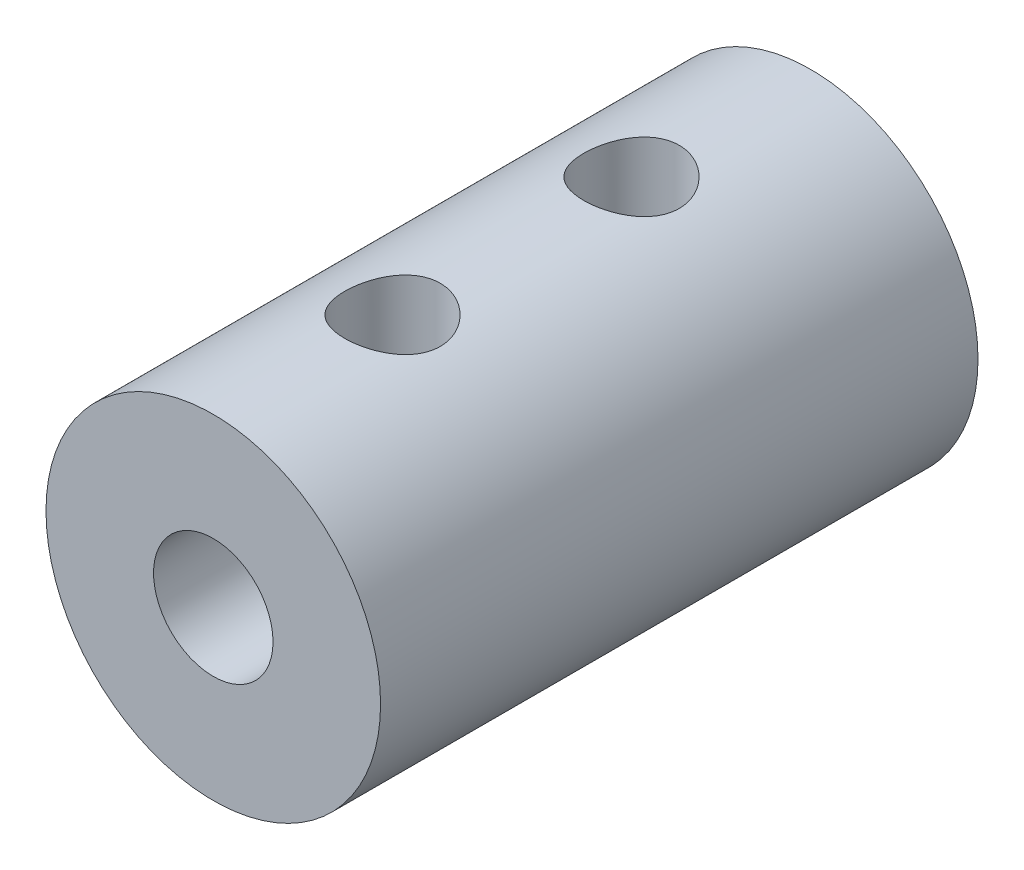
from build123d import *

# Parameters (mm, degrees)
SKETCH1_R               = 7
SKETCH1_R_2             = 4
BOSS_EXTRUDE1_DEPTH     = 25
BOSS_EXTRUDE2_START     = -12.5
SKETCH2_R               = 4
SKETCH2_R_2             = 2.5
BOSS_EXTRUDE2_DEPTH     = 12.5
CUT_EXTRUDE1_DEPTH      = 27.888659319
CUT_EXTRUDE1_DEPTH_BACK = 27.888659319
SKETCH3_R               = 2


with BuildPart() as part:
    # Sketch1 → Boss-Extrude1 (new body)
    with BuildSketch(Plane.XY):
        Circle(SKETCH1_R)
        Circle(SKETCH1_R_2, mode=Mode.SUBTRACT)
    extrude(amount=BOSS_EXTRUDE1_DEPTH)

    # Sketch2 → Boss-Extrude2 (add)
    with BuildSketch(Plane.XY.offset(25).offset(BOSS_EXTRUDE2_START)):
        Circle(SKETCH2_R)
        Circle(SKETCH2_R_2, mode=Mode.SUBTRACT)
    extrude(amount=BOSS_EXTRUDE2_DEPTH)

    # Sketch3 → Cut-Extrude1 (cut, two sides: drawn at the far end of the back side and taken through both)
    with BuildSketch(Plane(origin=(0, 0, 0), x_dir=(1, 0, 0), z_dir=(0, 1, 0)).offset(-CUT_EXTRUDE1_DEPTH_BACK)):
        with Locations(Location((0, -7.5, 0), (0, 0, 270))):
            Circle(SKETCH3_R)
        with Locations(Location((0, -17.5, 0), (0, 0, 270))):
            Circle(SKETCH3_R)
    extrude(amount=CUT_EXTRUDE1_DEPTH + CUT_EXTRUDE1_DEPTH_BACK, mode=Mode.SUBTRACT)


solid = part.part
